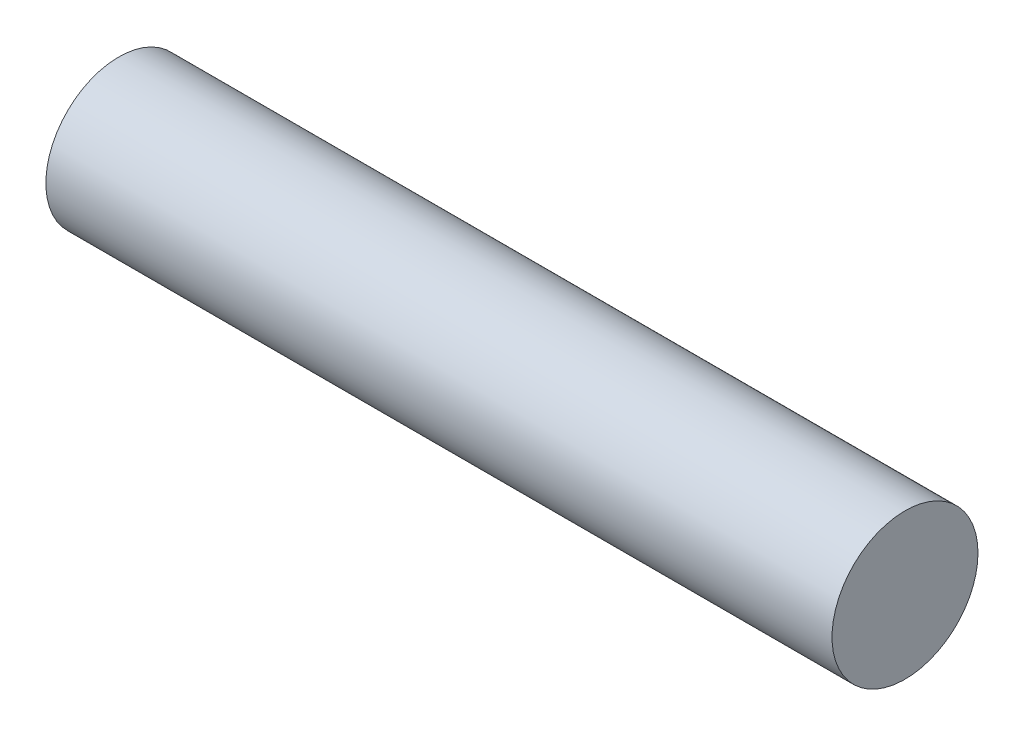
from build123d import *

# Parameters (mm, degrees)
SKETCH1_R           = 44.27
BOSS_EXTRUDE1_DEPTH = 476.85


with BuildPart() as part:
    # Sketch1 → Boss-Extrude1 (new body)
    with BuildSketch(Plane(origin=(0, 0, 0), x_dir=(0, 0, -1), z_dir=(1, 0, 0))):
        Circle(SKETCH1_R)
    extrude(amount=BOSS_EXTRUDE1_DEPTH)


solid = part.part
